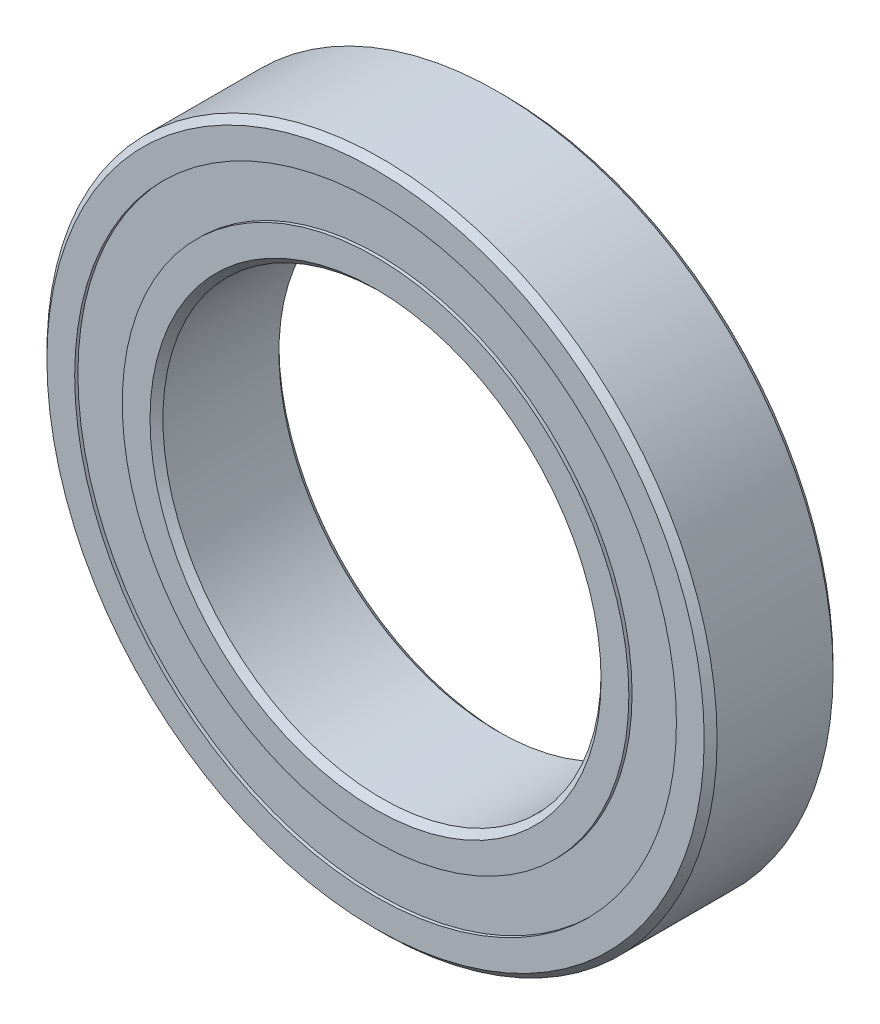
from build123d import *

# Parameters (mm, degrees)
CIRPATTERN1_COUNT = 12


with BuildPart() as part:
    # Sketch6 → Revolve1 (revolve)
    with BuildSketch(Plane(origin=(0, 0, 0), x_dir=(0, 0, -1), z_dir=(1, 0, 0))):
        with BuildLine():
            Line((-2.5000000000000004, 12.749999999999984), (-2.5000000000000004, 11.673076923076925))
            Line((-2.5000000000000004, 11.673076923076925), (-1.1111111111111114, 11.673076923076925))
            ThreePointArc((-1.1111111111111114, 11.673076923076925), (9e-17, 12.194520303475079), (1.1111111111111114, 11.673076923076925))
            Line((1.1111111111111114, 11.673076923076925), (2.5000000000000004, 11.673076923076925))
            Line((2.5000000000000004, 11.673076923076925), (2.5000000000000004, 12.749999999999991))
            Line((2.5000000000000004, 12.749999999999991), (2.2499999999999987, 12.999999999999998))
            Line((2.2499999999999987, 12.999999999999998), (-2.2499999999999987, 12.999999999999977))
            Line((-2.2499999999999987, 12.999999999999977), (-2.5000000000000004, 12.749999999999984))
        make_face()
        with BuildLine():
            Line((-2.5000000000000004, 8.750000000000014), (-2.5000000000000004, 9.82692307692308))
            Line((-2.5000000000000004, 9.82692307692308), (-1.1111111111111118, 9.82692307692308))
            ThreePointArc((-1.1111111111111118, 9.82692307692308), (-2.3e-16, 9.305479696524925), (1.111111111111111, 9.82692307692308))
            Line((1.111111111111111, 9.82692307692308), (2.5000000000000004, 9.82692307692308))
            Line((2.5000000000000004, 9.82692307692308), (2.5000000000000004, 8.750000000000014))
            Line((2.5000000000000004, 8.750000000000014), (2.2500000000000004, 8.500000000000007))
            Line((2.2500000000000004, 8.500000000000007), (-2.2500000000000004, 8.500000000000007))
            Line((-2.2500000000000004, 8.500000000000007), (-2.5000000000000004, 8.750000000000014))
        make_face()
    revolve(axis=Axis((0, 0, 2.5000000000000004), (0, 0, -1)))



with BuildPart() as body_2:
    # Sketch4 → Revolve2 (revolve)
    with BuildSketch(Plane(origin=(0, 0, 0), x_dir=(0, 0, -1), z_dir=(1, 0, 0))):
        with BuildLine():
            Line((-1.4445203034750762, 10.750000000000002), (1.4445203034750762, 10.750000000000002))
            ThreePointArc((1.4445203034750762, 10.750000000000002), (9e-17, 12.194520303475079), (-1.4445203034750762, 10.750000000000002))
        make_face()
    revolve(axis=Axis((0, 10.750000000000002, 1.4445203034750762), (0, 0, -1)))


with BuildPart() as cirpattern1_1:
    # CirPattern1: pattern copy
    add(body_2.part.rotate(Axis((0, 0, -2.5000000000000004), (0, 0, 1)), 1 * 360 / CIRPATTERN1_COUNT))


with BuildPart() as cirpattern1_2:
    # CirPattern1: pattern copy
    add(body_2.part.rotate(Axis((0, 0, -2.5000000000000004), (0, 0, 1)), 2 * 360 / CIRPATTERN1_COUNT))


with BuildPart() as cirpattern1_3:
    # CirPattern1: pattern copy
    add(body_2.part.rotate(Axis((0, 0, -2.5000000000000004), (0, 0, 1)), 3 * 360 / CIRPATTERN1_COUNT))


with BuildPart() as cirpattern1_4:
    # CirPattern1: pattern copy
    add(body_2.part.rotate(Axis((0, 0, -2.5000000000000004), (0, 0, 1)), 4 * 360 / CIRPATTERN1_COUNT))


with BuildPart() as cirpattern1_5:
    # CirPattern1: pattern copy
    add(body_2.part.rotate(Axis((0, 0, -2.5000000000000004), (0, 0, 1)), 5 * 360 / CIRPATTERN1_COUNT))


with BuildPart() as cirpattern1_6:
    # CirPattern1: pattern copy
    add(body_2.part.rotate(Axis((0, 0, -2.5000000000000004), (0, 0, 1)), 6 * 360 / CIRPATTERN1_COUNT))


with BuildPart() as cirpattern1_7:
    # CirPattern1: pattern copy
    add(body_2.part.rotate(Axis((0, 0, -2.5000000000000004), (0, 0, 1)), 7 * 360 / CIRPATTERN1_COUNT))


with BuildPart() as cirpattern1_8:
    # CirPattern1: pattern copy
    add(body_2.part.rotate(Axis((0, 0, -2.5000000000000004), (0, 0, 1)), 8 * 360 / CIRPATTERN1_COUNT))


with BuildPart() as cirpattern1_9:
    # CirPattern1: pattern copy
    add(body_2.part.rotate(Axis((0, 0, -2.5000000000000004), (0, 0, 1)), 9 * 360 / CIRPATTERN1_COUNT))


with BuildPart() as cirpattern1_10:
    # CirPattern1: pattern copy
    add(body_2.part.rotate(Axis((0, 0, -2.5000000000000004), (0, 0, 1)), 10 * 360 / CIRPATTERN1_COUNT))


with BuildPart() as cirpattern1_11:
    # CirPattern1: pattern copy
    add(body_2.part.rotate(Axis((0, 0, -2.5000000000000004), (0, 0, 1)), 11 * 360 / CIRPATTERN1_COUNT))


with BuildPart() as part_1:
    add(part.part)

    add(body_2.part)  # Revolve3 merges body 2

    add(cirpattern1_1.part)  # Revolve3 merges CirPattern1_1

    add(cirpattern1_2.part)  # Revolve3 merges CirPattern1_2

    add(cirpattern1_3.part)  # Revolve3 merges CirPattern1_3

    add(cirpattern1_4.part)  # Revolve3 merges CirPattern1_4

    add(cirpattern1_5.part)  # Revolve3 merges CirPattern1_5

    add(cirpattern1_6.part)  # Revolve3 merges CirPattern1_6

    add(cirpattern1_7.part)  # Revolve3 merges CirPattern1_7

    add(cirpattern1_8.part)  # Revolve3 merges CirPattern1_8

    add(cirpattern1_9.part)  # Revolve3 merges CirPattern1_9

    add(cirpattern1_10.part)  # Revolve3 merges CirPattern1_10

    add(cirpattern1_11.part)  # Revolve3 merges CirPattern1_11
    # Sketch5 → Revolve3 (revolve)
    with BuildSketch(Plane(origin=(0, 0, 0), x_dir=(0, 0, -1), z_dir=(1, 0, 0))):
        Polygon((-2.3749999999999987, 11.673076923076925), (-1.4445203034750762, 11.673076923076925), (-1.4445203034750753, 9.82692307692308), (-2.3749999999999987, 9.82692307692308), align=None)
        Polygon((2.3749999999999987, 11.673076923076925), (1.4445203034750762, 11.673076923076925), (1.444520303475077, 9.82692307692308), (2.3749999999999987, 9.82692307692308), align=None)
    revolve(axis=Axis((0, 0, 2.5000000000000004), (0, 0, -1)))


solid = part_1.part
